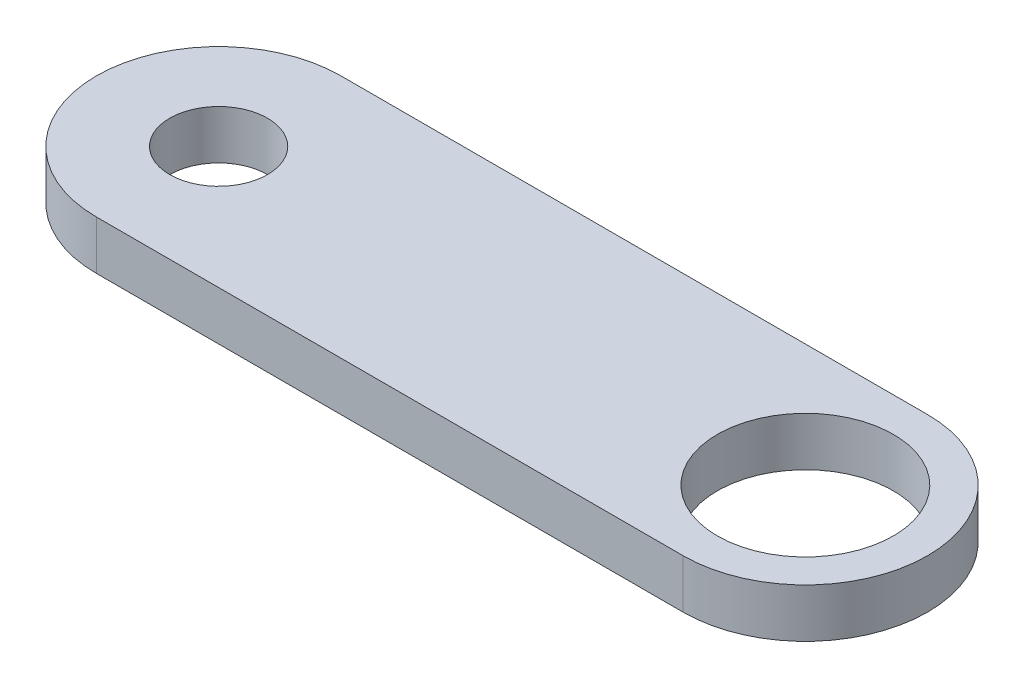
from build123d import *

# Parameters (mm, degrees)
SKETCH1_R           = 5
SKETCH1_R_2         = 9
BOSS_EXTRUDE1_DEPTH = 5


with BuildPart() as part:
    # Sketch1 → Boss-Extrude1 (new body)
    with BuildSketch(Plane(origin=(0, 0, 0), x_dir=(1, 0, 0), z_dir=(0, 1, 0))):
        with BuildLine():
            Line((0, 12.5), (60, 12.5))
            ThreePointArc((60, 12.5), (72.5, 0), (60, -12.5))
            Line((60, -12.5), (0, -12.5))
            ThreePointArc((0, -12.5), (-12.5, 0), (0, 12.5))
        make_face()
        with Locations(Location((0, 0, 0), (0, 0, 270))):
            Circle(SKETCH1_R, mode=Mode.SUBTRACT)
        with Locations(Location((60, 0, 0), (0, 0, 270))):
            Circle(SKETCH1_R_2, mode=Mode.SUBTRACT)
    extrude(amount=BOSS_EXTRUDE1_DEPTH)


solid = part.part
